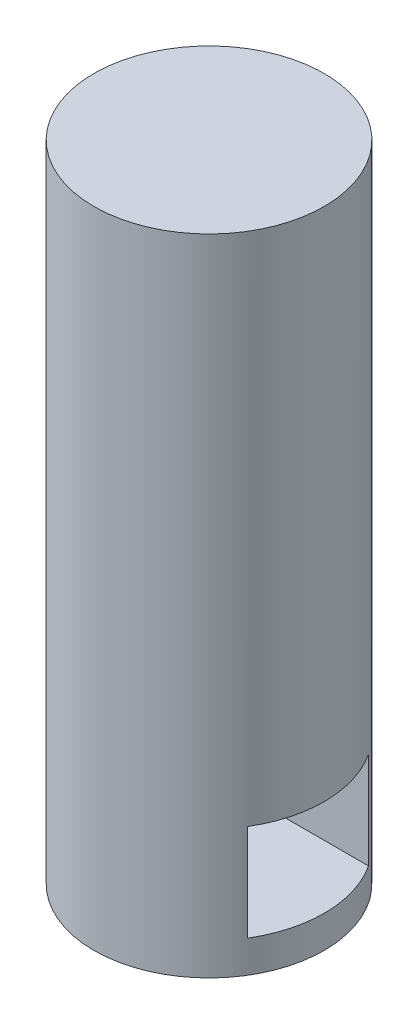
from build123d import *

# Parameters (mm, degrees)
SKETCH1_R           = 7.15
BOSS_EXTRUDE1_DEPTH = 40
SKETCH2_R           = 1
CUT_EXTRUDE1_DEPTH  = 4
SKETCH3_W           = 14.94180525
SKETCH3_H           = 7.642607054
CUT_EXTRUDE2_DEPTH  = 6


with BuildPart() as part:
    # Sketch1 → Boss-Extrude1 (new body)
    with BuildSketch(Plane(origin=(0, 0, 0), x_dir=(1, 0, 0), z_dir=(0, 1, 0))):
        with Locations(Location((0, 0, 0), (0, 0, 270))):
            Circle(SKETCH1_R)
    extrude(amount=BOSS_EXTRUDE1_DEPTH)

    # Sketch2 → Cut-Extrude1 (cut)
    with BuildSketch(Plane.XZ):
        with Locations(Location((0, 0, 0), (0, 0, 270))):
            Circle(SKETCH2_R)
    extrude(amount=-CUT_EXTRUDE1_DEPTH, mode=Mode.SUBTRACT)

    # Sketch3 → Cut-Extrude2 (cut)
    with BuildSketch(Plane(origin=(0, 2, 0), x_dir=(1, 0, 0), z_dir=(0, 1, 0))):
        with Locations((-0.076828784, 0.097224969)):
            Rectangle(SKETCH3_W, SKETCH3_H)
    extrude(amount=CUT_EXTRUDE2_DEPTH, mode=Mode.SUBTRACT)


solid = part.part
